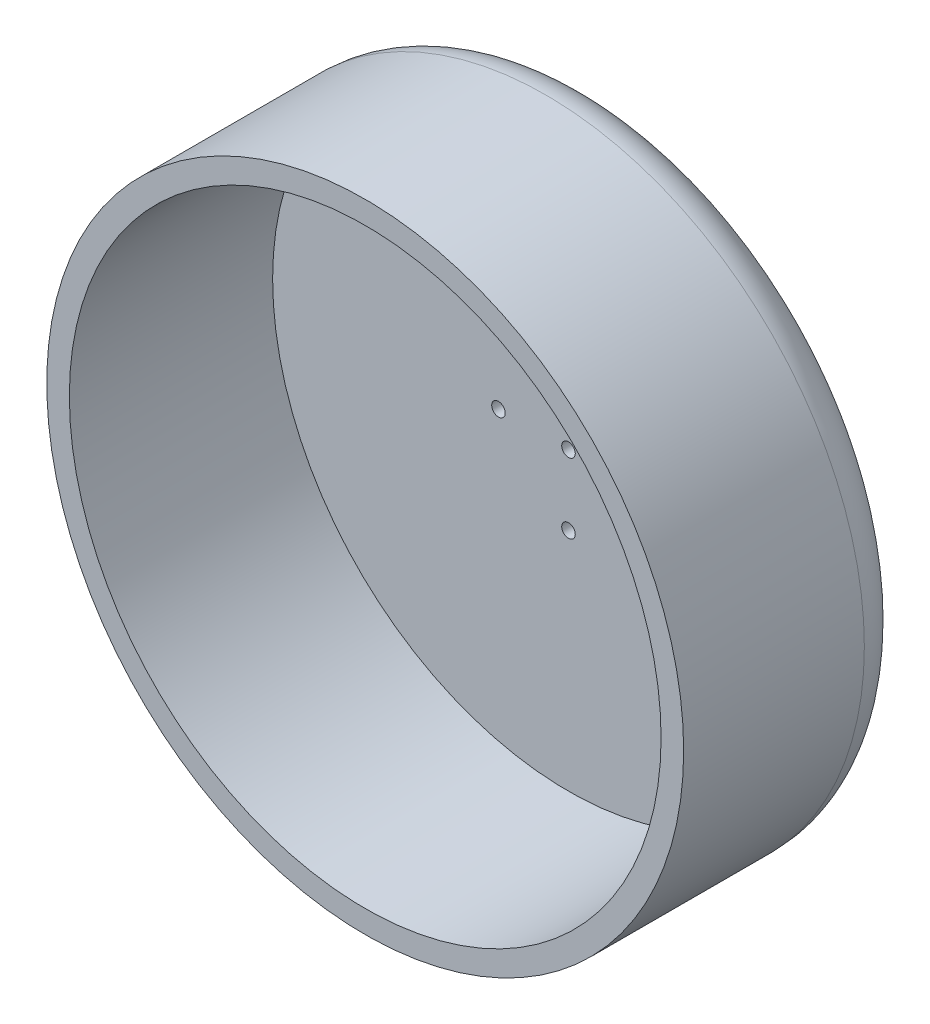
from build123d import *

# Parameters (mm, degrees)
CROQUIS1_R              = 70.5
CROQUIS1_R_2            = 1.5
SALIENTE_EXTRUIR1_DEPTH = 5
CROQUIS1_10_R           = 70.5
CROQUIS1_10_R_2         = 65.5
SALIENTE_EXTRUIR2_DEPTH = 50
REDONDEO1_R             = 10


with BuildPart() as part:
    # Croquis1 → Saliente-Extruir1 (new body)
    with BuildSketch(Plane.XY):
        Circle(CROQUIS1_R)
        with Locations((0, -15.5)):
            Circle(CROQUIS1_R_2, mode=Mode.SUBTRACT)
        with Locations((15.5, 0)):
            Circle(CROQUIS1_R_2, mode=Mode.SUBTRACT)
        with Locations((-15.5, 0)):
            Circle(CROQUIS1_R_2, mode=Mode.SUBTRACT)
        Circle(CROQUIS1_R_2, mode=Mode.SUBTRACT)
        with Locations((0, 15.5)):
            Circle(CROQUIS1_R_2, mode=Mode.SUBTRACT)
    extrude(amount=SALIENTE_EXTRUIR1_DEPTH)

    # Croquis1<10> → Saliente-Extruir2 (add)
    with BuildSketch(Plane.XY):
        Circle(CROQUIS1_10_R)
        Circle(CROQUIS1_10_R_2, mode=Mode.SUBTRACT)
    extrude(amount=SALIENTE_EXTRUIR2_DEPTH)

    # Redondeo1
    redondeo1_edges = [part.edges().sort_by_distance(p)[0] for p in [
        (-70.5, 0, 0),
    ]]
    fillet(redondeo1_edges, radius=REDONDEO1_R)


solid = part.part
